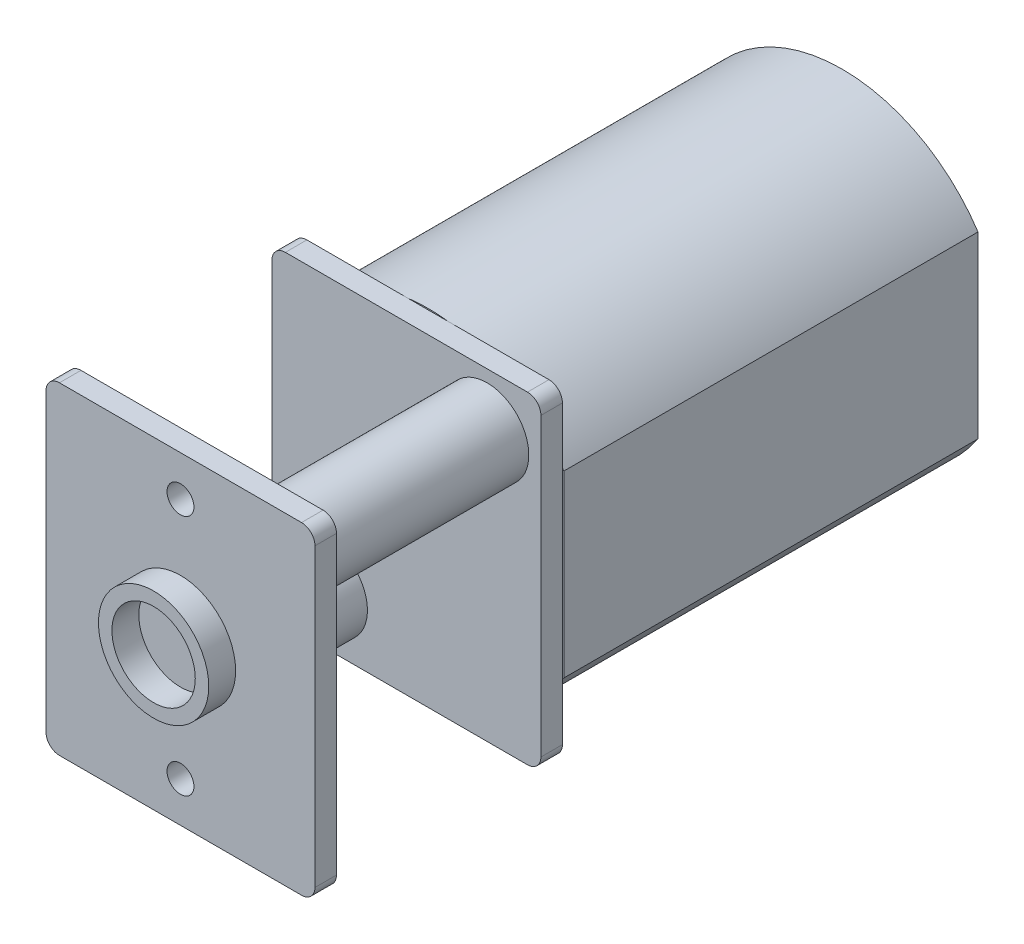
from build123d import *

# Parameters (mm, degrees)
EXTRUDE_1_DEPTH     = 15.4
SKETCH_2_R          = 2.52
SKETCH_2_R_2        = 0.8
EXTRUDE_2_DEPTH     = 1.1
SKETCH_5_W          = 10
SKETCH_5_H          = 12
EXTRUDE_3_DEPTH     = 0.8
SKETCH_7_R          = 1.55
EXTRUDE_4_DEPTH     = 7.6
SKETCH_8_W          = 10
SKETCH_8_H          = 12
EXTRUDE_5_DEPTH     = 0.8
SKETCH_9_R          = 2.05
SKETCH_9_R_2        = 1.55
EXTRUDE_6_DEPTH     = 1
FILLET_1_R          = 0.5
CUT_EXTRUDE_1_REACH = 28.881
SKETCH_10_R         = 0.5


with BuildPart() as part:
    # Эскиз1 → Бобышка-Вытянуть1 (new body)
    with BuildSketch(Plane.XY):
        with BuildLine():
            Line((5.05, -3.33166625), (5.05, 3.33166625))
            ThreePointArc((5.05, 3.33166625), (0, 6.05), (-5.05, 3.33166625))
            Line((-5.05, 3.33166625), (-5.05, -3.33166625))
            ThreePointArc((-5.05, -3.33166625), (0, -6.05), (5.05, -3.33166625))
        make_face()
    extrude(amount=EXTRUDE_1_DEPTH)

    # Эскиз2 → Бобышка-Вытянуть2 (add)
    with BuildSketch(Plane(origin=(0, 0, 0), x_dir=(-1, 0, 0), z_dir=(0, 0, -1))):
        Circle(SKETCH_2_R)
        Circle(SKETCH_2_R_2, mode=Mode.SUBTRACT)
    extrude(amount=EXTRUDE_2_DEPTH)

    # Эскиз5 → Бобышка-Вытянуть3 (add)
    with BuildSketch(Plane.XY.offset(15.4)):
        Rectangle(SKETCH_5_W, SKETCH_5_H)
    extrude(amount=EXTRUDE_3_DEPTH)

    # Эскиз7 → Бобышка-Вытянуть4 (add)
    with BuildSketch(Plane.XY.offset(16.2)):
        with Locations(Location((3, 4, 0), (0, 0, 180))):
            Circle(SKETCH_7_R)
        with Locations(Location((-3, -4, 0), (0, 0, 180))):
            Circle(SKETCH_7_R)
    extrude(amount=EXTRUDE_4_DEPTH)

    # Эскиз8 → Бобышка-Вытянуть5 (add)
    with BuildSketch(Plane.XY.offset(23.8)):
        Rectangle(SKETCH_8_W, SKETCH_8_H)
    extrude(amount=EXTRUDE_5_DEPTH)

    # Эскиз9 → Бобышка-Вытянуть6 (add)
    with BuildSketch(Plane.XY.offset(24.6)):
        Circle(SKETCH_9_R)
        Circle(SKETCH_9_R_2, mode=Mode.SUBTRACT)
    extrude(amount=EXTRUDE_6_DEPTH)

    # Скругление1
    fillet_1_edges = [part.edges().sort_by_distance(p)[0] for p in [
        (-5, 6, 15.8),
        (-5, -6, 15.8),
        (5, -6, 15.8),
        (5, 6, 15.8),
        (5, 6, 24.2),
        (-5, 6, 24.2),
        (-5, -6, 24.2),
        (5, -6, 24.2),
    ]]
    fillet(fillet_1_edges, radius=FILLET_1_R)

    # Эскиз10 → Вырез-Вытянуть1 (cut, up to next)
    with BuildSketch(Plane.XY.offset(24.6), mode=Mode.PRIVATE) as cut_extrude_1_sk1:
        with Locations((0, -4.5)):
            Circle(SKETCH_10_R)
    cut_extrude_1_tool1 = extrude(cut_extrude_1_sk1.sketch, amount=-CUT_EXTRUDE_1_REACH, mode=Mode.PRIVATE) & part.part
    # Эскиз10 → Вырез-Вытянуть1 (cut, up to next)
    with BuildSketch(Plane.XY.offset(24.6), mode=Mode.PRIVATE) as cut_extrude_1_sk2:
        with Locations((0, 4.5)):
            Circle(SKETCH_10_R)
    cut_extrude_1_tool2 = extrude(cut_extrude_1_sk2.sketch, amount=-CUT_EXTRUDE_1_REACH, mode=Mode.PRIVATE) & part.part
    add(cut_extrude_1_tool1.solids().sort_by_distance((0, -4.5, 24.6))[0], mode=Mode.SUBTRACT)
    add(cut_extrude_1_tool2.solids().sort_by_distance((0, 4.5, 24.6))[0], mode=Mode.SUBTRACT)


solid = part.part
